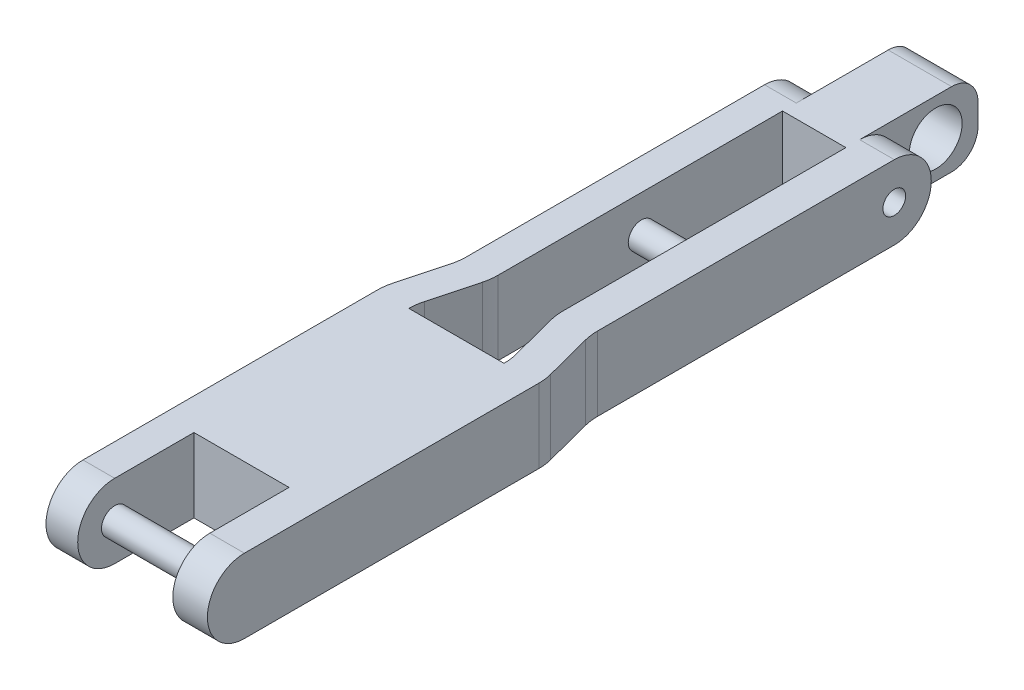
from build123d import *

# Parameters (mm, degrees)
EXTRUDE_2_DEPTH     = 14
FILLET_1_RADIUS     = 7
FILLET_1_LENGTH     = 6.553419282
FILLET_2_RADIUS     = 7
FILLET_2_LENGTH     = 6.553419282
CUT_EXTRUDE_1_REACH = 142.851
SKETCH_2_R          = 2.15
EXTRUDE_3_DEPTH     = 14
FILLET_3_RADIUS     = 7
FILLET_3_LENGTH     = 6
FILLET_4_RADIUS     = 7
FILLET_4_LENGTH     = 6
EXTRUDE_5_REACH     = 144.825
SKETCH_8_R          = 2.5
SKETCH_8_W          = 40.683862831
SKETCH_8_H          = 14
EXTRUDE_6_REACH     = 144.34
SKETCH_11_R         = 2.5
SKETCH_12_W         = 25
SKETCH_12_H         = 14
EXTRUDE_7_DEPTH     = 12
SKETCH_13_R         = 5
CUT_EXTRUDE_2_DEPTH = 12
FILLET_5_R          = 5


with BuildPart() as part:
    # 草图1 → 凸台-拉伸2 (new body)
    with BuildSketch(Plane(origin=(0, 0, 0), x_dir=(1, 0, 0), z_dir=(0, 1, 0))):
        with BuildLine():
            Line((5, 0), (5, 62.718048915))
            ThreePointArc((5, 62.718048915), (4.918829182, 63.989594298), (4.676634468, 65.240497206))
            Line((4.676634468, 65.240497206), (2.323365532, 74.268124597))
            ThreePointArc((2.323365532, 74.268124597), (2.081170818, 75.519027505), (2, 76.790572889))
            Line((2, 76.790572889), (2, 140))
            Line((2, 140), (-4.553419282, 140))
            Line((-4.553419282, 140), (-4.553419282, 76.790572889))
            ThreePointArc((-4.553419282, 76.790572889), (-4.472248464, 75.519027505), (-4.23005375, 74.268124597))
            Line((-4.23005375, 74.268124597), (-1.876784815, 65.240497206))
            ThreePointArc((-1.876784815, 65.240497206), (-1.6345901, 63.989594298), (-1.553419282, 62.718048915))
            Line((-1.553419282, 62.718048915), (-1.553419282, 0))
            Line((-1.553419282, 0), (5, 0))
        make_face()
    extrude(amount=EXTRUDE_2_DEPTH)

    # 圆角1: full round fillet: the end face becomes a half cylinder, R = half its width
    fillet_1_face = Plane((1.723290359, 7, 0), x_dir=(1, 0, 0), z_dir=(0, 0, 1))  # on the end face: x along it, z out of the body
    fillet_1_slab = fillet_1_face.offset(-FILLET_1_RADIUS / 2) * Box(FILLET_1_LENGTH, 2 * FILLET_1_RADIUS, FILLET_1_RADIUS, mode=Mode.PRIVATE)  # the body's end, R deep
    fillet_1_round = Plane((1.723290359, 7, -7), x_dir=(0, 0, 1), z_dir=(1, 0, 0)) * Cylinder(FILLET_1_RADIUS, FILLET_1_LENGTH, mode=Mode.PRIVATE)  # its axis R under the face
    add(fillet_1_slab - fillet_1_round, mode=Mode.SUBTRACT)

    # 圆角2: full round fillet: the end face becomes a half cylinder, R = half its width
    fillet_2_face = Plane((-1.276709641, 7, -140), x_dir=(-1, 0, 0), z_dir=(0, 0, -1))  # on the end face: x along it, z out of the body
    fillet_2_slab = fillet_2_face.offset(-FILLET_2_RADIUS / 2) * Box(FILLET_2_LENGTH, 2 * FILLET_2_RADIUS, FILLET_2_RADIUS, mode=Mode.PRIVATE)  # the body's end, R deep
    fillet_2_round = Plane((-1.276709641, 7, -133), x_dir=(0, 0, -1), z_dir=(-1, 0, 0)) * Cylinder(FILLET_2_RADIUS, FILLET_2_LENGTH, mode=Mode.PRIVATE)  # its axis R under the face
    add(fillet_2_slab - fillet_2_round, mode=Mode.SUBTRACT)

    # 草图2 → 切除-拉伸1 (cut, up to next)
    with BuildSketch(Plane(origin=(2, 0, 0), x_dir=(0, 0, -1), z_dir=(1, 0, 0)), mode=Mode.PRIVATE) as cut_extrude_1_sk1:
        with Locations((133, 7)):
            Circle(SKETCH_2_R)
    cut_extrude_1_tool1 = extrude(cut_extrude_1_sk1.sketch, amount=-CUT_EXTRUDE_1_REACH, mode=Mode.PRIVATE) & part.part
    add(cut_extrude_1_tool1.solids().sort_by_distance((2, 7, -133))[0], mode=Mode.SUBTRACT)

    # 草图8 → 凸台-拉伸5 (add, up to next)
    with BuildSketch(Plane(origin=(-19.553419282, 0, 0), x_dir=(0, 0, -1), z_dir=(1, 0, 0)), mode=Mode.PRIVATE) as extrude_5_sk1:
        with Locations(Location((7, 7, 0), (0, 0, 180))):
            Circle(SKETCH_8_R)
    extrude_5_tool1 = extrude(extrude_5_sk1.sketch, amount=EXTRUDE_5_REACH, mode=Mode.PRIVATE) - part.part
    # 草图8 → 凸台-拉伸5 (add, up to next)
    with BuildSketch(Plane(origin=(-19.553419282, 0, 0), x_dir=(0, 0, -1), z_dir=(1, 0, 0)), mode=Mode.PRIVATE) as extrude_5_sk2:
        with Locations((42.341931415, 7)):
            Rectangle(SKETCH_8_W, SKETCH_8_H)
    extrude_5_tool2 = extrude(extrude_5_sk2.sketch, amount=EXTRUDE_5_REACH, mode=Mode.PRIVATE) - part.part


with BuildPart() as body_2:
    # 草图4 → 凸台-拉伸3 (new body)
    with BuildSketch(Plane(origin=(0, 0, 0), x_dir=(1, 0, 0), z_dir=(0, 1, 0))):
        with BuildLine():
            Line((-19.553419282, 0), (-25.553419282, 0))
            Line((-25.553419282, 0), (-25.553419282, 62.683862831))
            ThreePointArc((-25.553419282, 62.683862831), (-25.467917646, 63.988746812), (-25.212874842, 65.271316849))
            Line((-25.212874842, 65.271316849), (-22.893963723, 73.928250938))
            ThreePointArc((-22.893963723, 73.928250938), (-22.638920919, 75.210820976), (-22.553419282, 76.515704957))
            Line((-22.553419282, 76.515704957), (-22.553419282, 140))
            Line((-22.553419282, 140), (-16.553419282, 140))
            Line((-16.553419282, 140), (-16.553419282, 76.515704957))
            ThreePointArc((-16.553419282, 76.515704957), (-16.638920919, 75.210820976), (-16.893963723, 73.928250938))
            Line((-16.893963723, 73.928250938), (-19.212874842, 65.271316849))
            ThreePointArc((-19.212874842, 65.271316849), (-19.467917646, 63.988746812), (-19.553419282, 62.683862831))
            Line((-19.553419282, 62.683862831), (-19.553419282, 0))
        make_face()
    extrude(amount=EXTRUDE_3_DEPTH)

    # 圆角3: full round fillet: the end face becomes a half cylinder, R = half its width
    fillet_3_face = Plane((-19.553419282, 7, -140), x_dir=(-1, 0, 0), z_dir=(0, 0, -1))  # on the end face: x along it, z out of the body
    fillet_3_slab = fillet_3_face.offset(-FILLET_3_RADIUS / 2) * Box(FILLET_3_LENGTH, 2 * FILLET_3_RADIUS, FILLET_3_RADIUS, mode=Mode.PRIVATE)  # the body's end, R deep
    fillet_3_round = Plane((-19.553419282, 7, -133), x_dir=(0, 0, -1), z_dir=(-1, 0, 0)) * Cylinder(FILLET_3_RADIUS, FILLET_3_LENGTH, mode=Mode.PRIVATE)  # its axis R under the face
    add(fillet_3_slab - fillet_3_round, mode=Mode.SUBTRACT)

    # 圆角4: full round fillet: the end face becomes a half cylinder, R = half its width
    fillet_4_face = Plane((-22.553419282, 7, 0), x_dir=(1, 0, 0), z_dir=(0, 0, 1))  # on the end face: x along it, z out of the body
    fillet_4_slab = fillet_4_face.offset(-FILLET_4_RADIUS / 2) * Box(FILLET_4_LENGTH, 2 * FILLET_4_RADIUS, FILLET_4_RADIUS, mode=Mode.PRIVATE)  # the body's end, R deep
    fillet_4_round = Plane((-22.553419282, 7, -7), x_dir=(0, 0, 1), z_dir=(1, 0, 0)) * Cylinder(FILLET_4_RADIUS, FILLET_4_LENGTH, mode=Mode.PRIVATE)  # its axis R under the face
    add(fillet_4_slab - fillet_4_round, mode=Mode.SUBTRACT)


with BuildPart() as part_1:
    add(part.part)

    add(body_2.part)  # 凸台-拉伸5 merges body 2
    add(extrude_5_tool1.solids().sort_by_distance((-19.553419, 7, -7))[0])
    add(extrude_5_tool2.solids().sort_by_distance((-19.553419, 7, -42.341931))[0])

    # 草图11 → 凸台-拉伸6 (add, up to next)
    with BuildSketch(Plane(origin=(-16.553419282, 0, 0), x_dir=(0, 0, -1), z_dir=(1, 0, 0)), mode=Mode.PRIVATE) as extrude_6_sk1:
        with Locations(Location((103.7, 7, 0), (0, 0, 180))):
            Circle(SKETCH_11_R)
    extrude_6_tool1 = extrude(extrude_6_sk1.sketch, amount=EXTRUDE_6_REACH, mode=Mode.PRIVATE) - part_1.part
    add(extrude_6_tool1.solids().sort_by_distance((-16.553419, 7, -103.7))[0])

    # 草图12 → 凸台-拉伸7 (add)
    with BuildSketch(Plane(origin=(-16.553419282, 0, 0), x_dir=(0, 0, -1), z_dir=(1, 0, 0))):
        with Locations((142.898160933, 7)):
            Rectangle(SKETCH_12_W, SKETCH_12_H)
    extrude(amount=EXTRUDE_7_DEPTH)

    # 草图13 → 切除-拉伸2 (cut)
    with BuildSketch(Plane.ZY.offset(16.553419282)):
        with Locations((-147.398160933, 7)):
            Circle(SKETCH_13_R)
    extrude(amount=-CUT_EXTRUDE_2_DEPTH, mode=Mode.SUBTRACT)

    # 圆角5
    fillet_5_edges = [part_1.edges().sort_by_distance(p)[0] for p in [
        (-10.553419282, 0, -155.398160933),
        (-10.553419282, 14, -155.398160933),
    ]]
    fillet(fillet_5_edges, radius=FILLET_5_R)


solid = part_1.part
